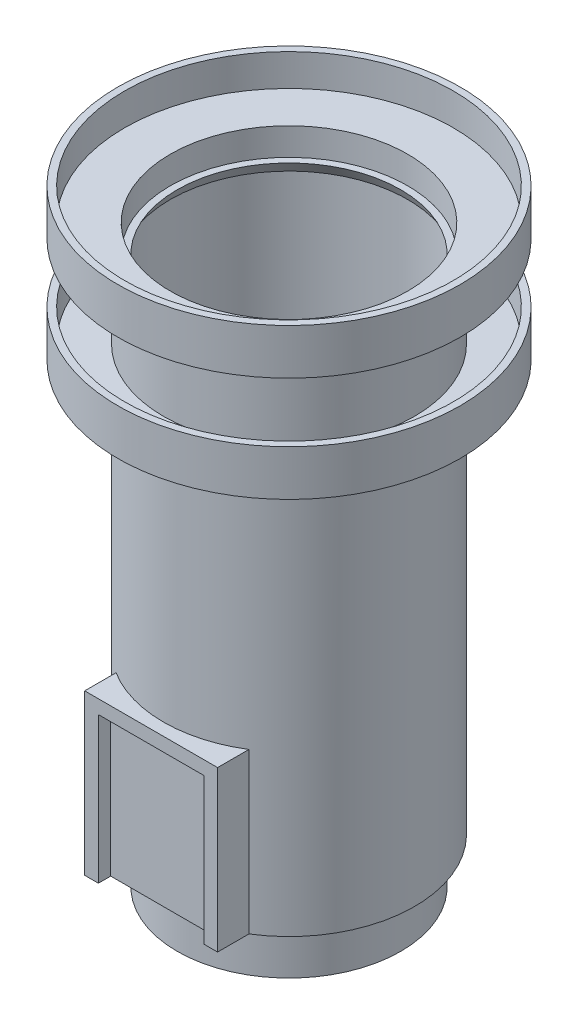
from build123d import *

# Parameters (mm, degrees)
SALIENTE_EXTRUIR1_DEPTH = 35
CROQUIS3_W              = 23.109686168
CROQUIS3_H              = 32
CORTAR_EXTRUIR1_DEPTH   = 2.7


with BuildPart() as part:
    # Croquis1 → Revolución1 (revolve)
    with BuildSketch(Plane.XY):
        Polygon((-40.712995514, 3.519897437), (-40.712995514, 16.519897437), (-43.712995514, 16.519897437), (-43.712995514, 120.917625562), (-42.212995514, 123.519897437), (-43.712995514, 123.519897437), (-43.712995514, 129.519897437), (-53.712995514, 129.519897437), (-53.712995514, 136.519897437), (-55.212995514, 136.519897437), (-55.212995514, 126.519897437), (-45.212995514, 123.519897437), (-45.212995514, 106.519897437), (-53.712995514, 106.519897437), (-53.712995514, 113.519897437), (-55.212995514, 113.519897437), (-55.212995514, 103.519897437), (-45.212995514, 100.519897437), (-45.212995514, 13.519897437), (-42.212995514, 13.519897437), (-42.212995514, 3.519897437), align=None)
    revolve(axis=Axis((-17.712995514, 104.262295082, 0), (0, -1, 0)))

    # Croquis2 → Saliente-Extruir1 (add)
    with BuildSketch(Plane.XZ.offset(-13.519897437)):
        with BuildLine():
            Line((-32.267838598, 23.332521141), (-32.267838598, 30.202521141))
            Line((-32.267838598, 30.202521141), (-3.15815243, 30.202521141))
            Line((-3.15815243, 30.202521141), (-3.15815243, 23.332521141))
            ThreePointArc((-3.15815243, 23.332521141), (-17.712995514, 27.5), (-32.267838598, 23.332521141))
        make_face()
    extrude(amount=-SALIENTE_EXTRUIR1_DEPTH)

    # Croquis3 → Cortar-Extruir1 (cut)
    with BuildSketch(Plane.XY.offset(30.202521141)):
        with Locations((-17.712995514, 29.519897437)):
            Rectangle(CROQUIS3_W, CROQUIS3_H)
    extrude(amount=-CORTAR_EXTRUIR1_DEPTH, mode=Mode.SUBTRACT)


solid = part.part
